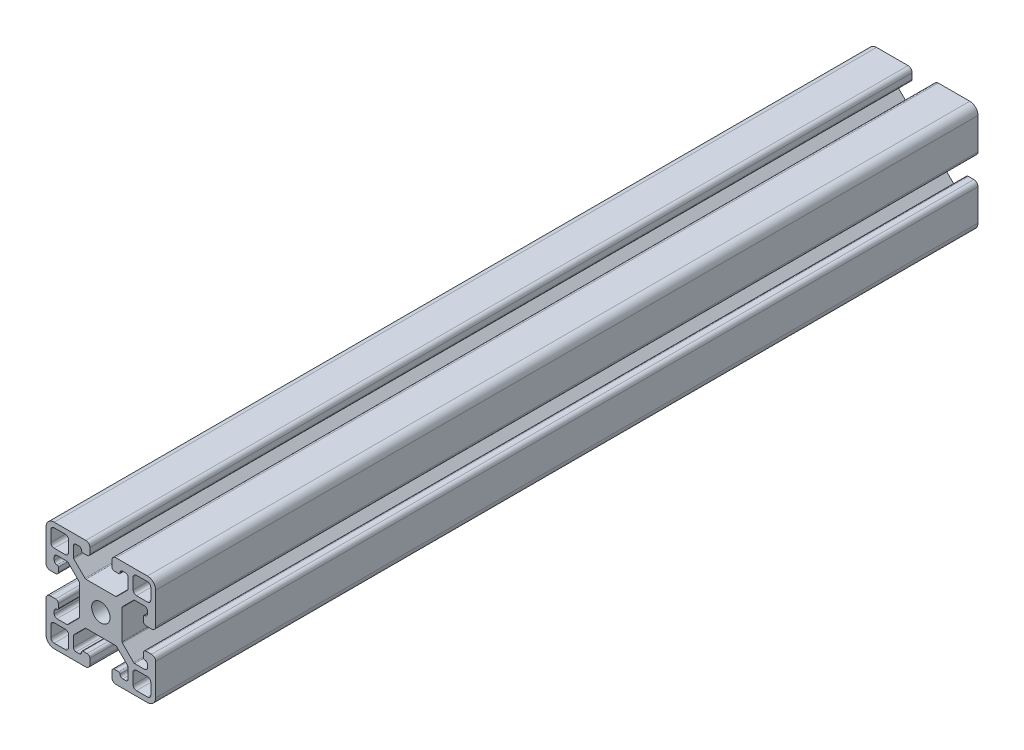
from build123d import *

# Parameters (mm, degrees)
SKETCH1_R           = 3.35
BOSS_EXTRUDE1_DEPTH = 300


with BuildPart() as part:
    # Sketch1 → Boss-Extrude1 (new body)
    with BuildSketch(Plane.XY):
        with BuildLine():
            Line((-9.853553391, -11.978553391), (-5.771446609, -7.896446609))
            ThreePointArc((-5.771446609, -7.896446609), (-5.609234935, -7.788060234), (-5.417893219, -7.75))
            Line((-5.417893219, -7.75), (5.417893219, -7.75))
            ThreePointArc((5.417893219, -7.75), (5.609234935, -7.788060234), (5.771446609, -7.896446609))
            Line((5.771446609, -7.896446609), (9.853553391, -11.978553391))
            ThreePointArc((9.853553391, -11.978553391), (9.961939766, -12.140765065), (10, -12.332106781))
            Line((10, -12.332106781), (10, -16))
            ThreePointArc((10, -16), (9.707106781, -16.707106781), (9, -17))
            Line((9, -17), (8, -17))
            ThreePointArc((8, -17), (7.292893219, -16.707106781), (7, -16))
            ThreePointArc((7, -16), (6.853553391, -15.646446609), (6.5, -15.5))
            Line((6.5, -15.5), (5, -15.5))
            ThreePointArc((5, -15.5), (4.292893219, -15.792893219), (4, -16.5))
            Line((4, -16.5), (4, -18.5))
            ThreePointArc((4, -18.5), (4.439339828, -19.560660172), (5.5, -20))
            Line((5.5, -20), (17, -20))
            ThreePointArc((17, -20), (19.121320344, -19.121320344), (20, -17))
            Line((20, -17), (20, -5.5))
            ThreePointArc((20, -5.5), (19.560660172, -4.439339828), (18.5, -4))
            Line((18.5, -4), (16.5, -4))
            ThreePointArc((16.5, -4), (15.792893219, -4.292893219), (15.5, -5))
            Line((15.5, -5), (15.5, -6.5))
            ThreePointArc((15.5, -6.5), (15.646446609, -6.853553391), (16, -7))
            ThreePointArc((16, -7), (16.707106781, -7.292893219), (17, -8))
            Line((17, -8), (17, -9))
            ThreePointArc((17, -9), (16.707106781, -9.707106781), (16, -10))
            Line((16, -10), (12.332106781, -10))
            ThreePointArc((12.332106781, -10), (12.140765065, -9.961939766), (11.978553391, -9.853553391))
            Line((11.978553391, -9.853553391), (7.896446609, -5.771446609))
            ThreePointArc((7.896446609, -5.771446609), (7.788060234, -5.609234935), (7.75, -5.417893219))
            Line((7.75, -5.417893219), (7.75, 5.417893219))
            ThreePointArc((7.75, 5.417893219), (7.788060234, 5.609234935), (7.896446609, 5.771446609))
            Line((7.896446609, 5.771446609), (11.978553391, 9.853553391))
            ThreePointArc((11.978553391, 9.853553391), (12.140765065, 9.961939766), (12.332106781, 10))
            Line((12.332106781, 10), (16, 10))
            ThreePointArc((16, 10), (16.707106781, 9.707106781), (17, 9))
            Line((17, 9), (17, 8))
            ThreePointArc((17, 8), (16.707106781, 7.292893219), (16, 7))
            ThreePointArc((16, 7), (15.646446609, 6.853553391), (15.5, 6.5))
            Line((15.5, 6.5), (15.5, 5))
            ThreePointArc((15.5, 5), (15.792893219, 4.292893219), (16.5, 4))
            Line((16.5, 4), (18.5, 4))
            ThreePointArc((18.5, 4), (19.560660172, 4.439339828), (20, 5.5))
            Line((20, 5.5), (20, 17))
            ThreePointArc((20, 17), (19.121320344, 19.121320344), (17, 20))
            Line((17, 20), (5.5, 20))
            ThreePointArc((5.5, 20), (4.439339828, 19.560660172), (4, 18.5))
            Line((4, 18.5), (4, 16.5))
            ThreePointArc((4, 16.5), (4.292893219, 15.792893219), (5, 15.5))
            Line((5, 15.5), (6.5, 15.5))
            ThreePointArc((6.5, 15.5), (6.853553391, 15.646446609), (7, 16))
            ThreePointArc((7, 16), (7.292893219, 16.707106781), (8, 17))
            Line((8, 17), (9, 17))
            ThreePointArc((9, 17), (9.707106781, 16.707106781), (10, 16))
            Line((10, 16), (10, 12.332106781))
            ThreePointArc((10, 12.332106781), (9.961939766, 12.140765065), (9.853553391, 11.978553391))
            Line((9.853553391, 11.978553391), (5.771446609, 7.896446609))
            ThreePointArc((5.771446609, 7.896446609), (5.609234935, 7.788060234), (5.417893219, 7.75))
            Line((5.417893219, 7.75), (-5.417893219, 7.75))
            ThreePointArc((-5.417893219, 7.75), (-5.609234935, 7.788060234), (-5.771446609, 7.896446609))
            Line((-5.771446609, 7.896446609), (-9.853553391, 11.978553391))
            ThreePointArc((-9.853553391, 11.978553391), (-9.961939766, 12.140765065), (-10, 12.332106781))
            Line((-10, 12.332106781), (-10, 16))
            ThreePointArc((-10, 16), (-9.707106781, 16.707106781), (-9, 17))
            Line((-9, 17), (-8, 17))
            ThreePointArc((-8, 17), (-7.292893219, 16.707106781), (-7, 16))
            ThreePointArc((-7, 16), (-6.853553391, 15.646446609), (-6.5, 15.5))
            Line((-6.5, 15.5), (-5, 15.5))
            ThreePointArc((-5, 15.5), (-4.292893219, 15.792893219), (-4, 16.5))
            Line((-4, 16.5), (-4, 18.5))
            ThreePointArc((-4, 18.5), (-4.439339828, 19.560660172), (-5.5, 20))
            Line((-5.5, 20), (-17, 20))
            ThreePointArc((-17, 20), (-19.121320344, 19.121320344), (-20, 17))
            Line((-20, 17), (-20, 5.5))
            ThreePointArc((-20, 5.5), (-19.560660172, 4.439339828), (-18.5, 4))
            Line((-18.5, 4), (-16.5, 4))
            ThreePointArc((-16.5, 4), (-15.792893219, 4.292893219), (-15.5, 5))
            Line((-15.5, 5), (-15.5, 6.5))
            ThreePointArc((-15.5, 6.5), (-15.646446609, 6.853553391), (-16, 7))
            ThreePointArc((-16, 7), (-16.707106781, 7.292893219), (-17, 8))
            Line((-17, 8), (-17, 9))
            ThreePointArc((-17, 9), (-16.707106781, 9.707106781), (-16, 10))
            Line((-16, 10), (-12.332106781, 10))
            ThreePointArc((-12.332106781, 10), (-12.140765065, 9.961939766), (-11.978553391, 9.853553391))
            Line((-11.978553391, 9.853553391), (-7.896446609, 5.771446609))
            ThreePointArc((-7.896446609, 5.771446609), (-7.788060234, 5.609234935), (-7.75, 5.417893219))
            Line((-7.75, 5.417893219), (-7.75, -5.417893219))
            ThreePointArc((-7.75, -5.417893219), (-7.788060234, -5.609234935), (-7.896446609, -5.771446609))
            Line((-7.896446609, -5.771446609), (-11.978553391, -9.853553391))
            ThreePointArc((-11.978553391, -9.853553391), (-12.140765065, -9.961939766), (-12.332106781, -10))
            Line((-12.332106781, -10), (-16, -10))
            ThreePointArc((-16, -10), (-16.707106781, -9.707106781), (-17, -9))
            Line((-17, -9), (-17, -8))
            ThreePointArc((-17, -8), (-16.707106781, -7.292893219), (-16, -7))
            ThreePointArc((-16, -7), (-15.646446609, -6.853553391), (-15.5, -6.5))
            Line((-15.5, -6.5), (-15.5, -5))
            ThreePointArc((-15.5, -5), (-15.792893219, -4.292893219), (-16.5, -4))
            Line((-16.5, -4), (-18.5, -4))
            ThreePointArc((-18.5, -4), (-19.560660172, -4.439339828), (-20, -5.5))
            Line((-20, -5.5), (-20, -17))
            ThreePointArc((-20, -17), (-19.121320344, -19.121320344), (-17, -20))
            Line((-17, -20), (-5.5, -20))
            ThreePointArc((-5.5, -20), (-4.439339828, -19.560660172), (-4, -18.5))
            Line((-4, -18.5), (-4, -16.5))
            ThreePointArc((-4, -16.5), (-4.292893219, -15.792893219), (-5, -15.5))
            Line((-5, -15.5), (-6.5, -15.5))
            ThreePointArc((-6.5, -15.5), (-6.853553391, -15.646446609), (-7, -16))
            ThreePointArc((-7, -16), (-7.292893219, -16.707106781), (-8, -17))
            Line((-8, -17), (-9, -17))
            ThreePointArc((-9, -17), (-9.707106781, -16.707106781), (-10, -16))
            Line((-10, -16), (-10, -12.332106781))
            ThreePointArc((-10, -12.332106781), (-9.961939766, -12.140765065), (-9.853553391, -11.978553391))
        make_face()
        Circle(SKETCH1_R, mode=Mode.SUBTRACT)
        with BuildLine():
            Line((-17, 11.78), (-13, 11.78))
            ThreePointArc((-13, 11.78), (-12.137329727, 12.137329727), (-11.78, 13))
            Line((-11.78, 13), (-11.78, 17))
            ThreePointArc((-11.78, 17), (-12.137329727, 17.862670273), (-13, 18.22))
            Line((-13, 18.22), (-17, 18.22))
            ThreePointArc((-17, 18.22), (-17.862670273, 17.862670273), (-18.22, 17))
            Line((-18.22, 17), (-18.22, 13))
            ThreePointArc((-18.22, 13), (-17.862670273, 12.137329727), (-17, 11.78))
        make_face(mode=Mode.SUBTRACT)
        with BuildLine():
            Line((-18.22, -13), (-18.22, -17))
            ThreePointArc((-18.22, -17), (-17.862670273, -17.862670273), (-17, -18.22))
            Line((-17, -18.22), (-13, -18.22))
            ThreePointArc((-13, -18.22), (-12.137329727, -17.862670273), (-11.78, -17))
            Line((-11.78, -17), (-11.78, -13))
            ThreePointArc((-11.78, -13), (-12.137329727, -12.137329727), (-13, -11.78))
            Line((-13, -11.78), (-17, -11.78))
            ThreePointArc((-17, -11.78), (-17.862670273, -12.137329727), (-18.22, -13))
        make_face(mode=Mode.SUBTRACT)
        with BuildLine():
            Line((13, -18.22), (17, -18.22))
            ThreePointArc((17, -18.22), (17.862670273, -17.862670273), (18.22, -17))
            Line((18.22, -17), (18.22, -13))
            ThreePointArc((18.22, -13), (17.862670273, -12.137329727), (17, -11.78))
            Line((17, -11.78), (13, -11.78))
            ThreePointArc((13, -11.78), (12.137329727, -12.137329727), (11.78, -13))
            Line((11.78, -13), (11.78, -17))
            ThreePointArc((11.78, -17), (12.137329727, -17.862670273), (13, -18.22))
        make_face(mode=Mode.SUBTRACT)
        with BuildLine():
            Line((18.22, 13), (18.22, 17))
            ThreePointArc((18.22, 17), (17.862670273, 17.862670273), (17, 18.22))
            Line((17, 18.22), (13, 18.22))
            ThreePointArc((13, 18.22), (12.137329727, 17.862670273), (11.78, 17))
            Line((11.78, 17), (11.78, 13))
            ThreePointArc((11.78, 13), (12.137329727, 12.137329727), (13, 11.78))
            Line((13, 11.78), (17, 11.78))
            ThreePointArc((17, 11.78), (17.862670273, 12.137329727), (18.22, 13))
        make_face(mode=Mode.SUBTRACT)
    extrude(amount=BOSS_EXTRUDE1_DEPTH)


solid = part.part
